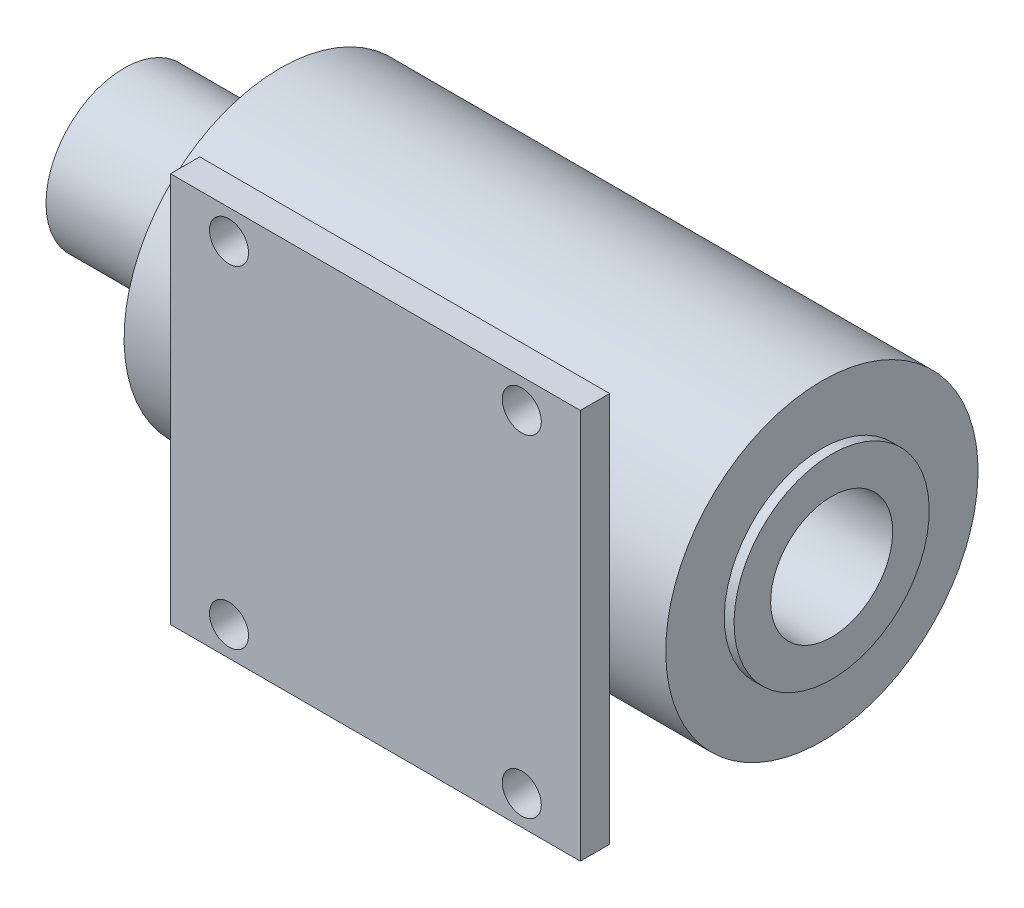
from build123d import *

# Parameters (mm, degrees)
SKETCH1_W                = 42
SKETCH1_H                = 40
SKETCH1_R                = 2
BOSS_EXTRUDE1_DEPTH      = 3
BOSS_EXTRUDE2_DEPTH      = 27.75
BOSS_EXTRUDE2_DEPTH_BACK = 27.75
SKETCH2_R                = 16
SKETCH3_R                = 8
BOSS_EXTRUDE3_DEPTH      = 16
SKETCH4_R                = 10
BOSS_EXTRUDE4_DEPTH      = 1
SKETCH5_R                = 6.25
CUT_EXTRUDE1_DEPTH       = 51
SKETCH6_R                = 2.38125
CUT_EXTRUDE2_DEPTH       = 66.54475261


with BuildPart() as part:
    # Sketch1 → Boss-Extrude1 (new body)
    with BuildSketch(Plane.XY):
        with Locations((9.820372205, -5.905879539)):
            Rectangle(SKETCH1_W, SKETCH1_H)
        with Locations((-5.179627795, 11.094120461)):
            Circle(SKETCH1_R, mode=Mode.SUBTRACT)
        with Locations((-5.179627795, -22.905879539)):
            Circle(SKETCH1_R, mode=Mode.SUBTRACT)
        with Locations((24.820372205, 11.094120461)):
            Circle(SKETCH1_R, mode=Mode.SUBTRACT)
        with Locations((24.820372205, -22.905879539)):
            Circle(SKETCH1_R, mode=Mode.SUBTRACT)
    extrude(amount=BOSS_EXTRUDE1_DEPTH)


with BuildPart() as body_2:
    # Sketch2 → Boss-Extrude2 (new, two sides: drawn at the far end of the back side and taken through both)
    with BuildSketch(Plane(origin=(8.820372205, 0, 0), x_dir=(0, 0, -1), z_dir=(1, 0, 0)).offset(-BOSS_EXTRUDE2_DEPTH_BACK)):
        with Locations(Location((16, -5.905879539, 0), (0, 0, 90))):
            Circle(SKETCH2_R)
    extrude(amount=BOSS_EXTRUDE2_DEPTH + BOSS_EXTRUDE2_DEPTH_BACK)

    # Sketch3 → Boss-Extrude3 (add)
    with BuildSketch(Plane.ZY.offset(18.929627795)):
        with Locations(Location((-16, -5.905879539, 0), (0, 0, 90))):
            Circle(SKETCH3_R)
    extrude(amount=BOSS_EXTRUDE3_DEPTH)

    # Sketch4 → Boss-Extrude4 (add)
    with BuildSketch(Plane(origin=(36.570372205, 0, 0), x_dir=(0, 0, -1), z_dir=(1, 0, 0))):
        with Locations(Location((16, -5.905879539, 0), (0, 0, 90))):
            Circle(SKETCH4_R)
    extrude(amount=BOSS_EXTRUDE4_DEPTH)

    # Sketch5 → Cut-Extrude1 (cut)
    with BuildSketch(Plane(origin=(37.570372205, 0, 0), x_dir=(0, 0, -1), z_dir=(1, 0, 0))):
        with Locations(Location((16, -5.905879539, 0), (0, 0, 90))):
            Circle(SKETCH5_R)
    extrude(amount=-CUT_EXTRUDE1_DEPTH, mode=Mode.SUBTRACT)

    # Sketch6 → Cut-Extrude2 (cut, through all)
    with BuildSketch(Plane(origin=(-13.429627795, 0, 0), x_dir=(0, 0, -1), z_dir=(1, 0, 0))):
        with Locations(Location((16, -5.905879539, 0), (0, 0, 90))):
            Circle(SKETCH6_R)
    extrude(amount=-CUT_EXTRUDE2_DEPTH, mode=Mode.SUBTRACT)


solid = Compound([part.part, body_2.part])
